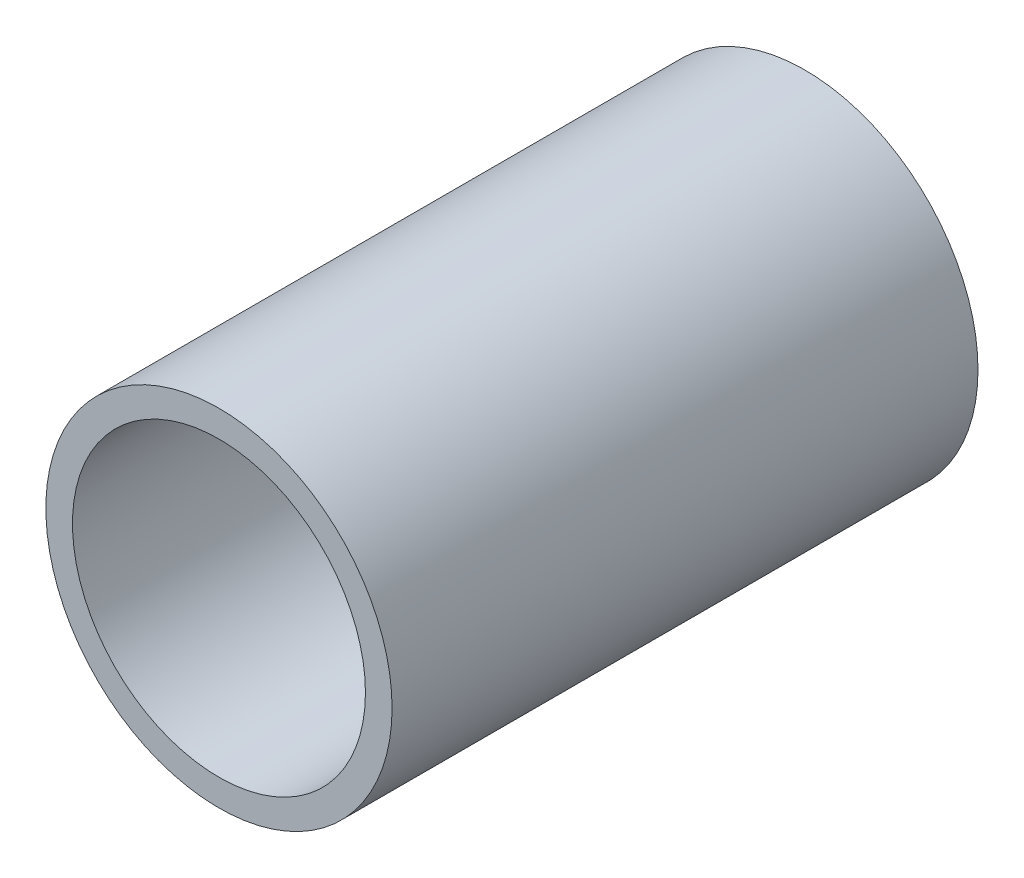
from build123d import *

# Parameters (mm, degrees)
SKETCH2_R           = 3.25
SKETCH2_R_2         = 2.75
BOSS_EXTRUDE1_DEPTH = 11


with BuildPart() as part:
    # Sketch2 → Boss-Extrude1 (new body)
    with BuildSketch(Plane.XY):
        Circle(SKETCH2_R)
        Circle(SKETCH2_R_2, mode=Mode.SUBTRACT)
    extrude(amount=BOSS_EXTRUDE1_DEPTH)


solid = part.part
